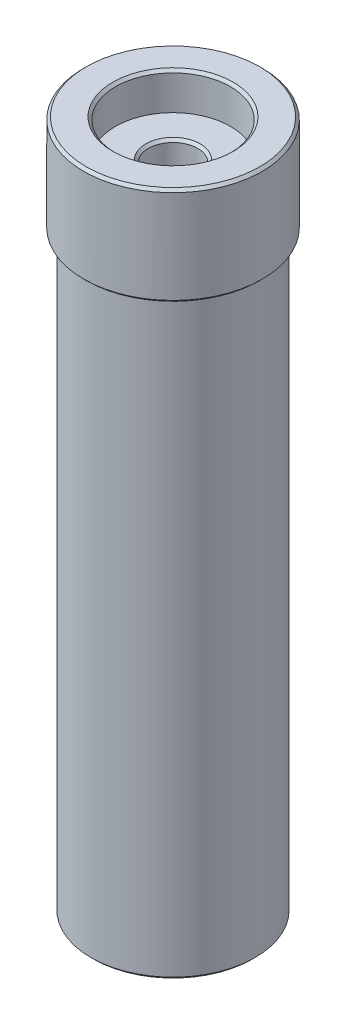
from build123d import *

# Parameters (mm, degrees)
SKETCH1_R                    = 15.875
BOSS_EXTRUDE1_DEPTH          = 114.3
SKETCH2_R                    = 17.272
BOSS_EXTRUDE2_DEPTH          = 19.05
SKETCH10_R                   = 11.1125
CUT_EXTRUDE1_DEPTH           = 7.1628
F_3_8_0_375_DIAMETER_HOLE1_D = 9.525
SKETCH15_R                   = 11.7078125
CUT_EXTRUDE3_DEPTH           = 111.125
SKETCH16_R                   = 8.334375
CUT_EXTRUDE4_DEPTH           = 7.9375
CHAMFER2_SIZE                = 0.508


with BuildPart() as part:
    # Sketch1 → Boss-Extrude1 (new body)
    with BuildSketch(Plane(origin=(0, 0, 0), x_dir=(1, 0, 0), z_dir=(0, 1, 0))):
        with Locations(Location((0, 0, 0), (0, 0, 270))):
            Circle(SKETCH1_R)
    extrude(amount=BOSS_EXTRUDE1_DEPTH)

    # Sketch2 → Boss-Extrude2 (add)
    with BuildSketch(Plane(origin=(0, 114.3, 0), x_dir=(1, 0, 0), z_dir=(0, 1, 0))):
        with Locations(Location((0, 0, 0), (0, 0, 90))):
            Circle(SKETCH2_R)
    extrude(amount=BOSS_EXTRUDE2_DEPTH)

    # Sketch10 → Cut-Extrude1 (cut)
    with BuildSketch(Plane(origin=(0, 133.35, 0), x_dir=(1, 0, 0), z_dir=(0, 1, 0))):
        with Locations(Location((0, 0, 0), (0, 0, 270))):
            Circle(SKETCH10_R)
    extrude(amount=-CUT_EXTRUDE1_DEPTH, mode=Mode.SUBTRACT)

    # 3/8 (0.375) Diameter Hole1 (through all)
    with Locations(Plane(origin=(0, 126.1872, 0), x_dir=(1, 0, 0), z_dir=(0, 1, 0))):
        with Locations((0, 0)):
            Hole(F_3_8_0_375_DIAMETER_HOLE1_D / 2)

    # Sketch15 → Cut-Extrude3 (cut)
    with BuildSketch(Plane.XZ):
        with Locations(Location((0, 0, 0), (0, 0, 270))):
            Circle(SKETCH15_R)
    extrude(amount=-CUT_EXTRUDE3_DEPTH, mode=Mode.SUBTRACT)

    # Sketch16 → Cut-Extrude4 (cut)
    with BuildSketch(Plane.XZ.offset(-111.125)):
        with Locations(Location((0, 0, 0), (0, 0, 270))):
            Circle(SKETCH16_R)
    extrude(amount=-CUT_EXTRUDE4_DEPTH, mode=Mode.SUBTRACT)

    # Chamfer2
    chamfer2_edges = [part.edges().sort_by_distance(p)[0] for p in [
        (0, 133.35, -11.1125),
        (4.7625, 126.1872, 0),
        (0, 0, -15.875),
        (0, 114.3, 17.272),
        (0, 133.35, 17.272),
    ]]
    chamfer(chamfer2_edges, length=CHAMFER2_SIZE)


solid = part.part
